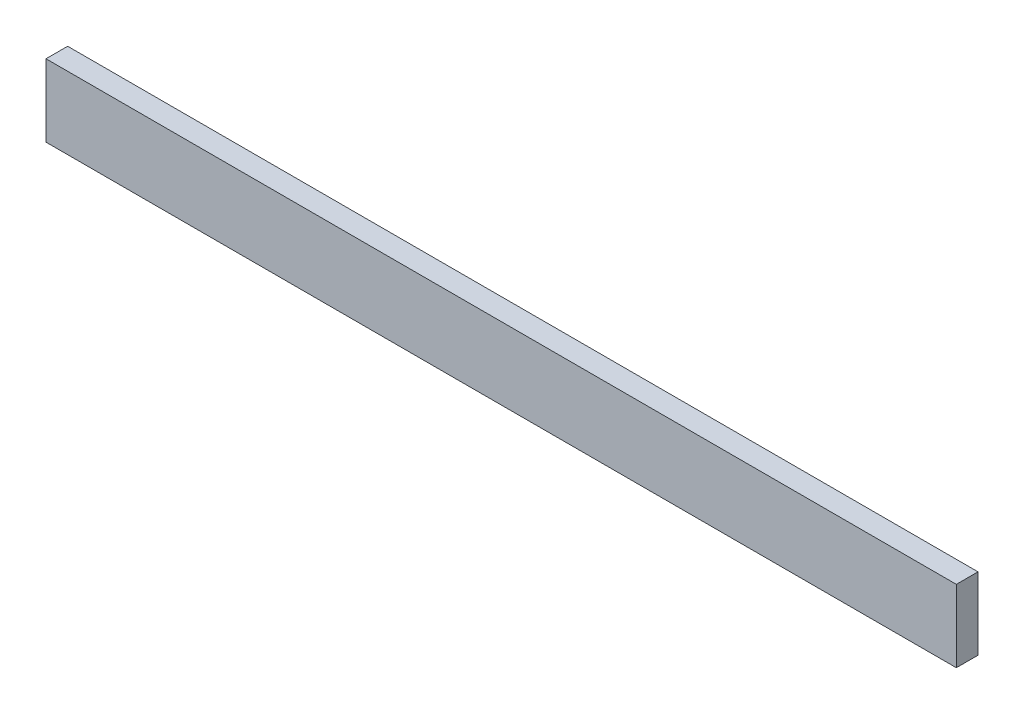
from build123d import *

# Parameters (mm, degrees)
SKETCH1_W           = 160.02
SKETCH1_H           = 12.7
BOSS_EXTRUDE1_DEPTH = 3.81


with BuildPart() as part:
    # Sketch1 → Boss-Extrude1 (new body)
    with BuildSketch(Plane.XY):
        Rectangle(SKETCH1_W, SKETCH1_H)
    extrude(amount=BOSS_EXTRUDE1_DEPTH)


solid = part.part
